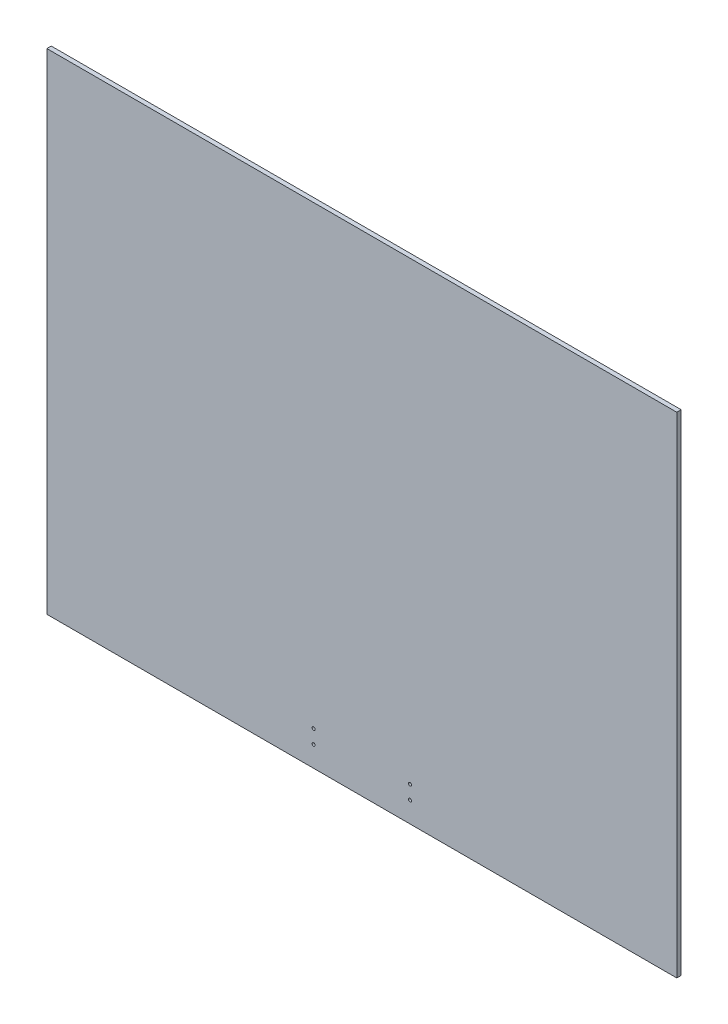
from build123d import *

# Parameters (mm, degrees)
SKETCH1_W           = 914.4
SKETCH1_H           = 711.2
BOSS_EXTRUDE1_DEPTH = 6.35
SKETCH2_R           = 2.2
CUT_EXTRUDE2_DEPTH  = 580.243923145


with BuildPart() as part:
    # Sketch1 → Boss-Extrude1 (new body)
    with BuildSketch(Plane.XY):
        Rectangle(SKETCH1_W, SKETCH1_H)
    extrude(amount=BOSS_EXTRUDE1_DEPTH)

    # Sketch2 → Cut-Extrude2 (cut, through all)
    with BuildSketch(Plane.XY.offset(6.35)):
        with Locations((70, -305.6)):
            Circle(SKETCH2_R)
        with Locations((70, -325.6)):
            Circle(SKETCH2_R)
        with Locations((-70, -305.6)):
            Circle(SKETCH2_R)
        with Locations((-70, -325.6)):
            Circle(SKETCH2_R)
    extrude(amount=-CUT_EXTRUDE2_DEPTH, mode=Mode.SUBTRACT)


solid = part.part
